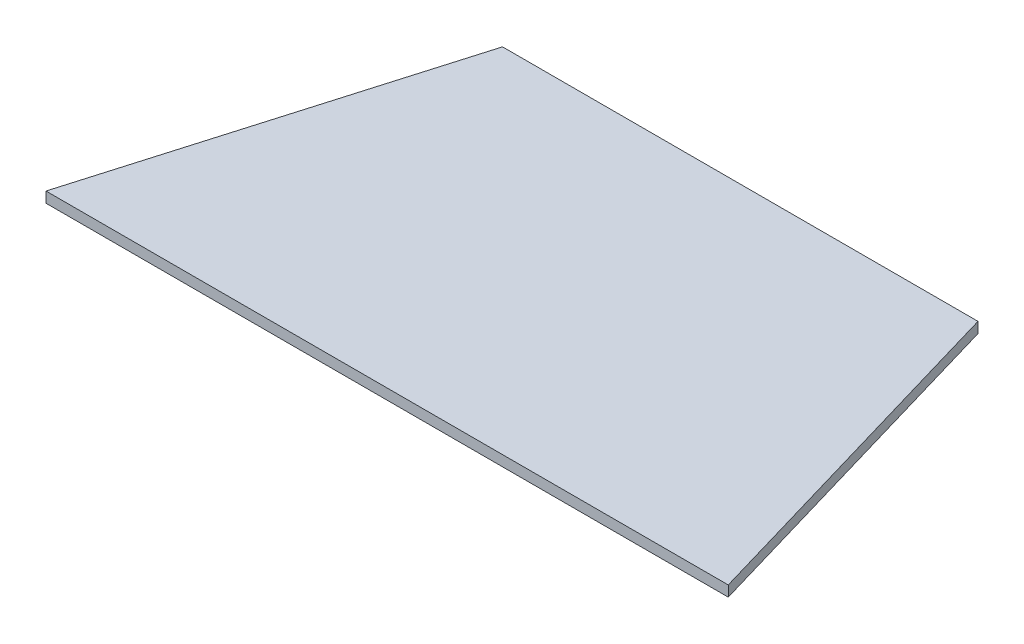
from build123d import *

# Parameters (mm, degrees)
BOSS_EXTRUDE1_DEPTH = 3


with BuildPart() as part:
    # Sketch1 → Boss-Extrude1 (new body)
    with BuildSketch(Plane(origin=(0, 0, 0), x_dir=(1, 0, 0), z_dir=(0, 1, 0))):
        Polygon((-13.2, 0), (180, 0), (150.720058283, 100), (16.079941717, 100), align=None)
    extrude(amount=BOSS_EXTRUDE1_DEPTH)


solid = part.part
